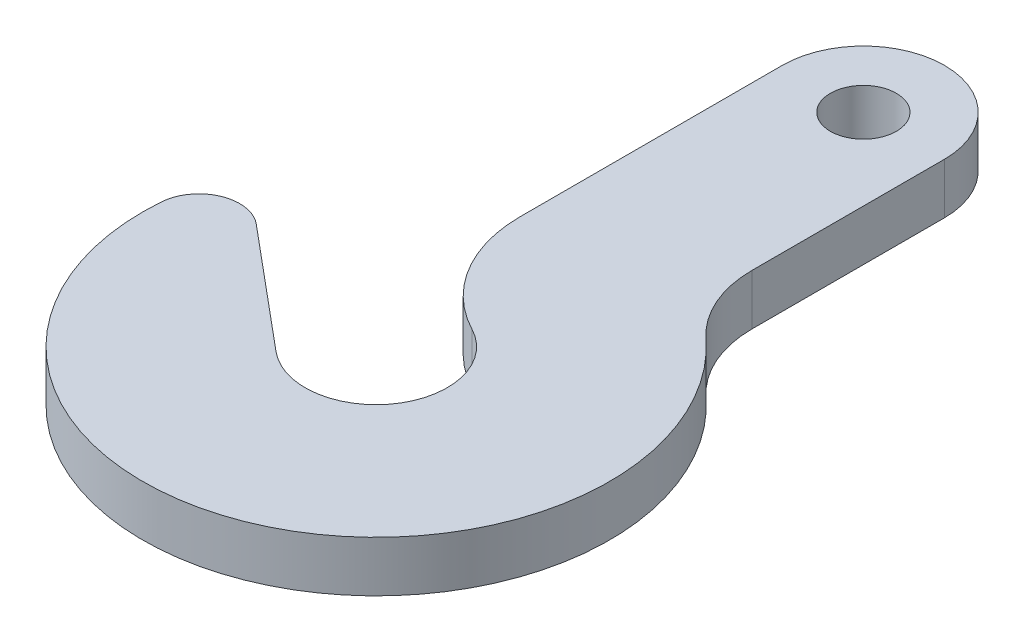
from build123d import *

# Parameters (mm, degrees)
SKETCH1_R           = 6.5
BOSS_EXTRUDE1_DEPTH = 10


with BuildPart() as part:
    # Sketch1 → Boss-Extrude1 (new body)
    with BuildSketch(Plane(origin=(0, 0, 0), x_dir=(1, 0, 0), z_dir=(0, 1, 0))):
        with BuildLine():
            Line((16, 88), (16, 50.079936102))
            ThreePointArc((16, 50.079936102), (17.85785805, 41.23153977), (23.117647059, 33.877603834))
            ThreePointArc((23.117647059, 33.877603834), (8.830347529, -42.810505744), (-53.85766764, 3.615842732))
            ThreePointArc((-53.85766764, 3.615842732), (-48.982974202, 10.361725626), (-40.752437215, 9.125670194))
            Line((-40.752437215, 9.125670194), (-16.977471788, -10.742671935))
            ThreePointArc((-16.977471788, -10.742671935), (3.641076169, -7.777232518), (-1.512195122, 12.405981939))
            ThreePointArc((-1.512195122, 12.405981939), (-12.095770915, 22.346620452), (-16, 36.331804249))
            Line((-16, 36.331804249), (-16, 88))
            ThreePointArc((-16, 88), (0, 104), (16, 88))
        make_face()
        with Locations(Location((0, 88, 0), (0, 0, 270))):
            Circle(SKETCH1_R, mode=Mode.SUBTRACT)
    extrude(amount=BOSS_EXTRUDE1_DEPTH)


solid = part.part
